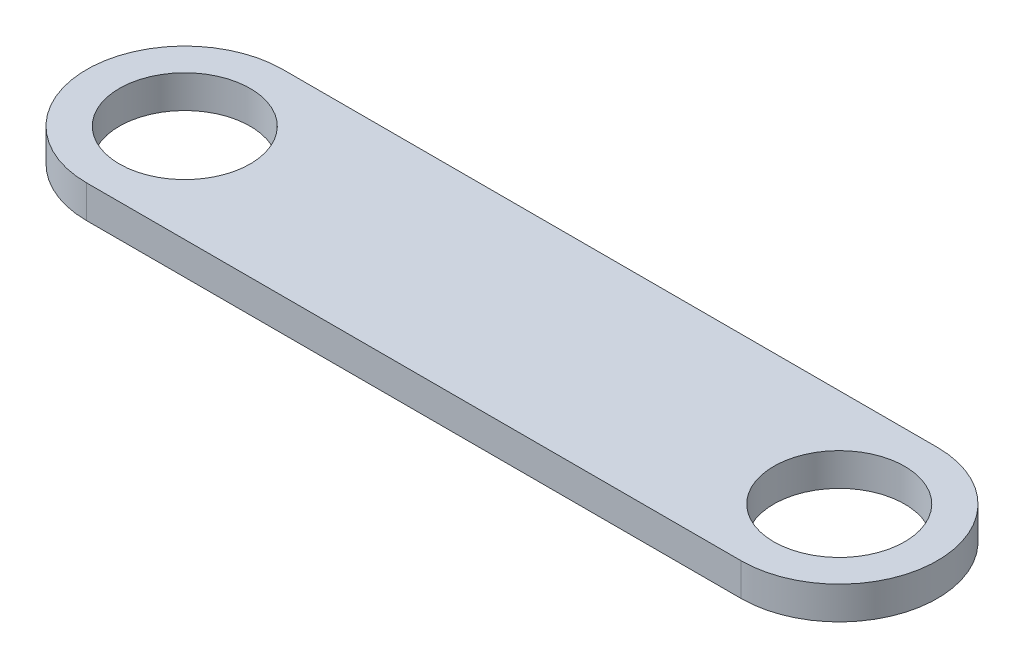
from build123d import *

# Parameters (mm, degrees)
SKETCH1_R           = 10
BOSS_EXTRUDE1_DEPTH = 5


with BuildPart() as part:
    # Sketch1 → Boss-Extrude1 (new body)
    with BuildSketch(Plane(origin=(0, 0, 0), x_dir=(1, 0, 0), z_dir=(0, 1, 0))):
        with BuildLine():
            Line((0, -15), (100, -15))
            ThreePointArc((100, -15), (115, 0), (100, 15))
            Line((100, 15), (0, 15))
            ThreePointArc((0, 15), (-15, 0), (0, -15))
        make_face()
        with Locations(Location((100, 0, 0), (0, 0, 270))):
            Circle(SKETCH1_R, mode=Mode.SUBTRACT)
        with Locations(Location((0, 0, 0), (0, 0, 270))):
            Circle(SKETCH1_R, mode=Mode.SUBTRACT)
    extrude(amount=BOSS_EXTRUDE1_DEPTH)


solid = part.part
